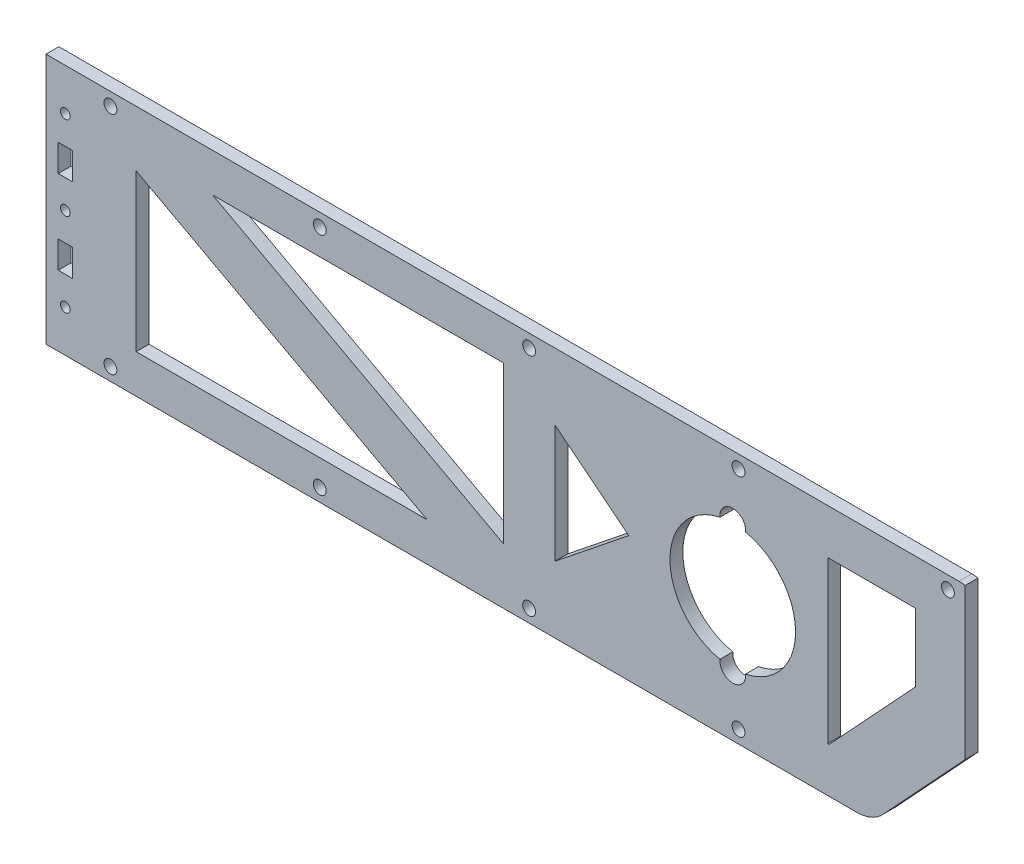
from build123d import *

# Parameters (mm, degrees)
SKETCH_1_R          = 1.5
SKETCH_1_R_2        = 2
SKETCH_1_W          = 4.4
SKETCH_1_H          = 8.4
EXTRUDE_1_DEPTH     = 4
CUT_EXTRUDE_1_DEPTH = 10


with BuildPart() as part:
    # 草图1 → 凸台-拉伸1 (new body)
    with BuildSketch(Plane.XY):
        with BuildLine():
            Line((-6, 39), (-6, -39))
            Line((-6, -39), (245.772887801, -39))
            ThreePointArc((245.772887801, -39), (250.169785399, -38.08301996), (253.833616208, -35.484962093))
            Line((253.833616208, -35.484962093), (285.490974876, -1.392421989))
            ThreePointArc((285.490974876, -1.392421989), (287.669094365, 2.071844423), (288.430246468, 6.092540104))
            Line((288.430246468, 6.092540104), (288.430246468, 28))
            ThreePointArc((288.430246468, 28), (285.208421061, 35.778174593), (277.430246468, 39))
            Line((277.430246468, 39), (-6, 39))
        make_face()
        Circle(SKETCH_1_R, mode=Mode.SUBTRACT)
        with Locations((0, 26)):
            Circle(SKETCH_1_R, mode=Mode.SUBTRACT)
        with Locations((0, -26)):
            Circle(SKETCH_1_R, mode=Mode.SUBTRACT)
        with Locations((274, 35)):
            Circle(SKETCH_1_R_2, mode=Mode.SUBTRACT)
        with Locations((209, 35)):
            Circle(SKETCH_1_R_2, mode=Mode.SUBTRACT)
        with Locations((144, 35)):
            Circle(SKETCH_1_R_2, mode=Mode.SUBTRACT)
        with Locations((79, 35)):
            Circle(SKETCH_1_R_2, mode=Mode.SUBTRACT)
        with Locations((14, 35)):
            Circle(SKETCH_1_R_2, mode=Mode.SUBTRACT)
        with Locations((209, -35)):
            Circle(SKETCH_1_R_2, mode=Mode.SUBTRACT)
        with Locations((144, -35)):
            Circle(SKETCH_1_R_2, mode=Mode.SUBTRACT)
        with Locations((79, -35)):
            Circle(SKETCH_1_R_2, mode=Mode.SUBTRACT)
        with Locations((14, -35)):
            Circle(SKETCH_1_R_2, mode=Mode.SUBTRACT)
        with Locations((0, 13)):
            Rectangle(SKETCH_1_W, SKETCH_1_H, mode=Mode.SUBTRACT)
        with Locations((0, -13)):
            Rectangle(SKETCH_1_W, SKETCH_1_H, mode=Mode.SUBTRACT)
        Polygon((112.268773645, -27), (22, -27), (22, 21.606262732), align=None, mode=Mode.SUBTRACT)
        Polygon((45.731226355, 27), (136, 27), (136, -21.606262732), align=None, mode=Mode.SUBTRACT)
        Polygon((152, 18.345484713), (152, -18.345484713), (174.910889623, 0), align=None, mode=Mode.SUBTRACT)
        Polygon((236.71, -25), (236.71, 25), (264, 25), (264, 3.926902442), (237.139304875, -25), align=None, mode=Mode.SUBTRACT)
        with BuildLine():
            ThreePointArc((203.231094412, 19.08974359), (187.71, 0), (203.231094412, -19.08974359))
            ThreePointArc((203.231094412, -19.08974359), (207.21, -23.5), (211.188905588, -19.08974359))
            ThreePointArc((211.188905588, -19.08974359), (226.71, 0), (211.188905588, 19.08974359))
            ThreePointArc((211.188905588, 19.08974359), (207.21, 23.5), (203.231094412, 19.08974359))
        make_face(mode=Mode.SUBTRACT)
    extrude(amount=EXTRUDE_1_DEPTH)

    # 草图2 → 切除-拉伸1 (cut)
    with BuildSketch(Plane.XY.offset(4)):
        Polygon((279.349775131, 38.831223833), (279.349775131, -8.006021715), (315.852962883, -9.139766663), (310.030210466, 44.302513286), align=None)
    extrude(amount=-CUT_EXTRUDE_1_DEPTH, mode=Mode.SUBTRACT)


solid = part.part
